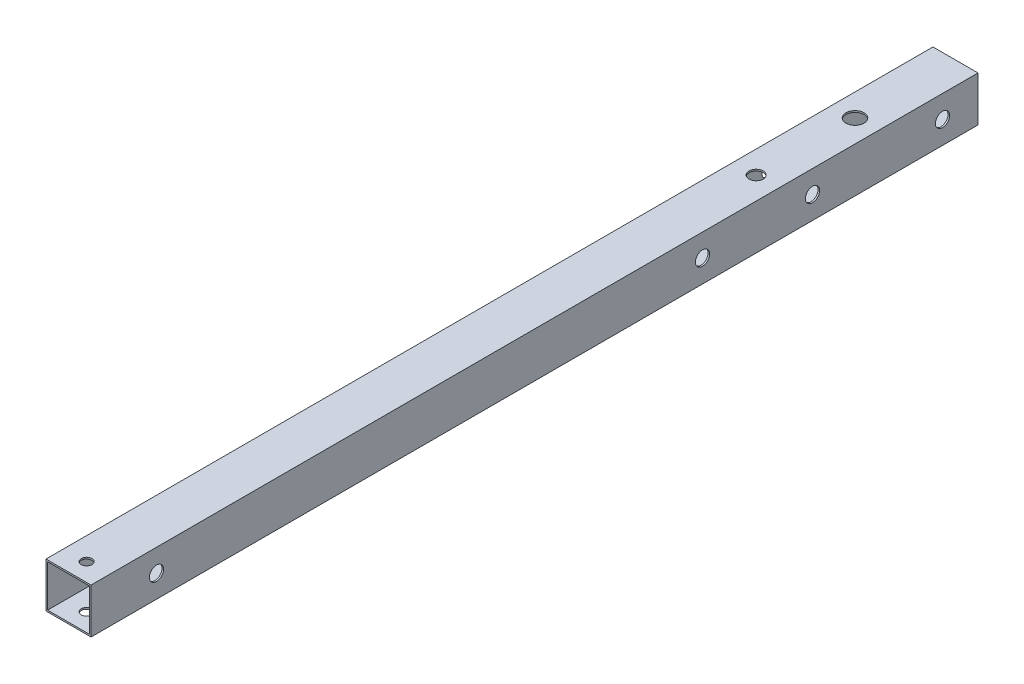
from build123d import *

# Parameters (mm, degrees)
SKETCH1_W           = 25.4
SKETCH1_H           = 25.4
SKETCH1_W_2         = 23.6
SKETCH1_H_2         = 23.6
EXTRUDE_THIN1_DEPTH = 250
SKETCH2_R           = 4
CUT_EXTRUDE1_DEPTH  = 252.607730406
SKETCH3_R           = 3
SKETCH3_R_2         = 4
SKETCH3_R_3         = 5.1
CUT_EXTRUDE2_DEPTH  = 252.607730406


with BuildPart() as part:
    # Sketch1 → Extrude-Thin1 (new, symmetric)
    with BuildSketch(Plane.XY):
        Rectangle(SKETCH1_W, SKETCH1_H)
        Rectangle(SKETCH1_W_2, SKETCH1_H_2, mode=Mode.SUBTRACT)
    extrude(amount=EXTRUDE_THIN1_DEPTH, both=True)

    # Sketch2 → Cut-Extrude1 (cut, through all)
    with BuildSketch(Plane(origin=(12.7, 0, 0), x_dir=(0, 0, -1), z_dir=(1, 0, 0))):
        with Locations(Location((156.7, 0, 0), (0, 0, 90))):
            Circle(SKETCH2_R)
        with Locations(Location((230, 0, 0), (0, 0, 90))):
            Circle(SKETCH2_R)
        with Locations(Location((94.7, 0, 0), (0, 0, 90))):
            Circle(SKETCH2_R)
        with Locations(Location((-213.12, 0, 0), (0, 0, 90))):
            Circle(SKETCH2_R)
    extrude(amount=-CUT_EXTRUDE1_DEPTH, mode=Mode.SUBTRACT)

    # Sketch3 → Cut-Extrude2 (cut, through all)
    with BuildSketch(Plane.XZ.offset(12.7)):
        with Locations(Location((0, 239.8, 0), (0, 0, 270))):
            Circle(SKETCH3_R)
        with Locations(Location((0, -137.65, 0), (0, 0, 270))):
            Circle(SKETCH3_R_2)
        with Locations(Location((0, -193.35, 0), (0, 0, 270))):
            Circle(SKETCH3_R_3)
    extrude(amount=-CUT_EXTRUDE2_DEPTH, mode=Mode.SUBTRACT)


solid = part.part
